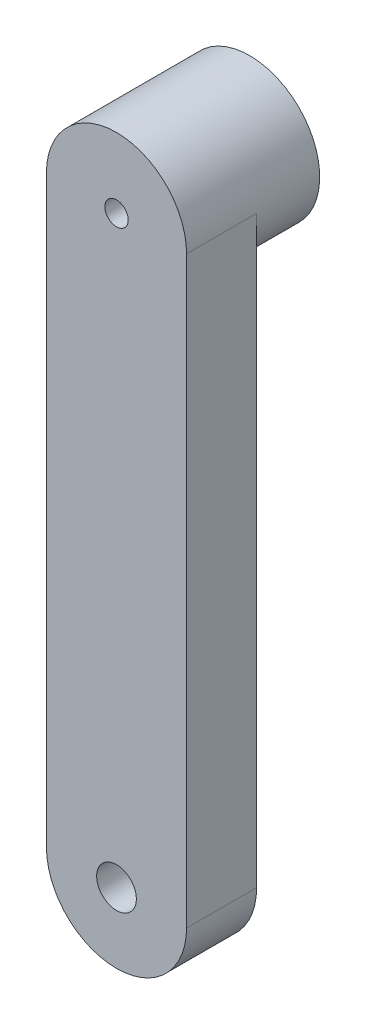
from build123d import *

# Parameters (mm, degrees)
RESSALTO_EXTRUS_O1_DEPTH = 3
CORTE_EXTRUS_O1_REACH    = 30.32
ESBO_O2_R                = 0.85
RESSALTO_EXTRUS_O2_START = 2.7
ESBO_O4_R                = 3
RESSALTO_EXTRUS_O2_DEPTH = 2.7
CORTE_EXTRUS_O2_REACH    = 30.731
ESBO_O3_R                = 0.5


with BuildPart() as part:
    # Esboço1 → Ressalto-extrusão1 (new body)
    with BuildSketch(Plane.XY):
        with BuildLine():
            Line((-3, 0), (-3, 25))
            ThreePointArc((-3, 25), (0, 28), (3, 25))
            Line((3, 25), (3, 0))
            ThreePointArc((3, 0), (0, -3), (-3, 0))
        make_face()
    extrude(amount=RESSALTO_EXTRUS_O1_DEPTH)

    # Esboço2 → Corte-extrusão1 (cut, up to next)
    with BuildSketch(Plane.XY.offset(3), mode=Mode.PRIVATE) as corte_extrus_o1_sk1:
        Circle(ESBO_O2_R)
    corte_extrus_o1_tool1 = extrude(corte_extrus_o1_sk1.sketch, amount=-CORTE_EXTRUS_O1_REACH, mode=Mode.PRIVATE) & part.part
    add(corte_extrus_o1_tool1.solids().sort_by_distance((0, 0, 3))[0], mode=Mode.SUBTRACT)

    # Esboço4 → Ressalto-extrusão2 (add)
    with BuildSketch(Plane(origin=(0, 0, 0), x_dir=(-1, 0, 0), z_dir=(0, 0, -1)).offset(RESSALTO_EXTRUS_O2_START)):
        with Locations((0, 25)):
            Circle(ESBO_O4_R)
    extrude(amount=-RESSALTO_EXTRUS_O2_DEPTH)

    # Esboço3 → Corte-extrusão2 (cut, up to next)
    with BuildSketch(Plane.XY.offset(3), mode=Mode.PRIVATE) as corte_extrus_o2_sk1:
        with Locations((0, 25)):
            Circle(ESBO_O3_R)
    corte_extrus_o2_tool1 = extrude(corte_extrus_o2_sk1.sketch, amount=-CORTE_EXTRUS_O2_REACH, mode=Mode.PRIVATE) & part.part
    add(corte_extrus_o2_tool1.solids().sort_by_distance((0, 25, 3))[0], mode=Mode.SUBTRACT)


solid = part.part
